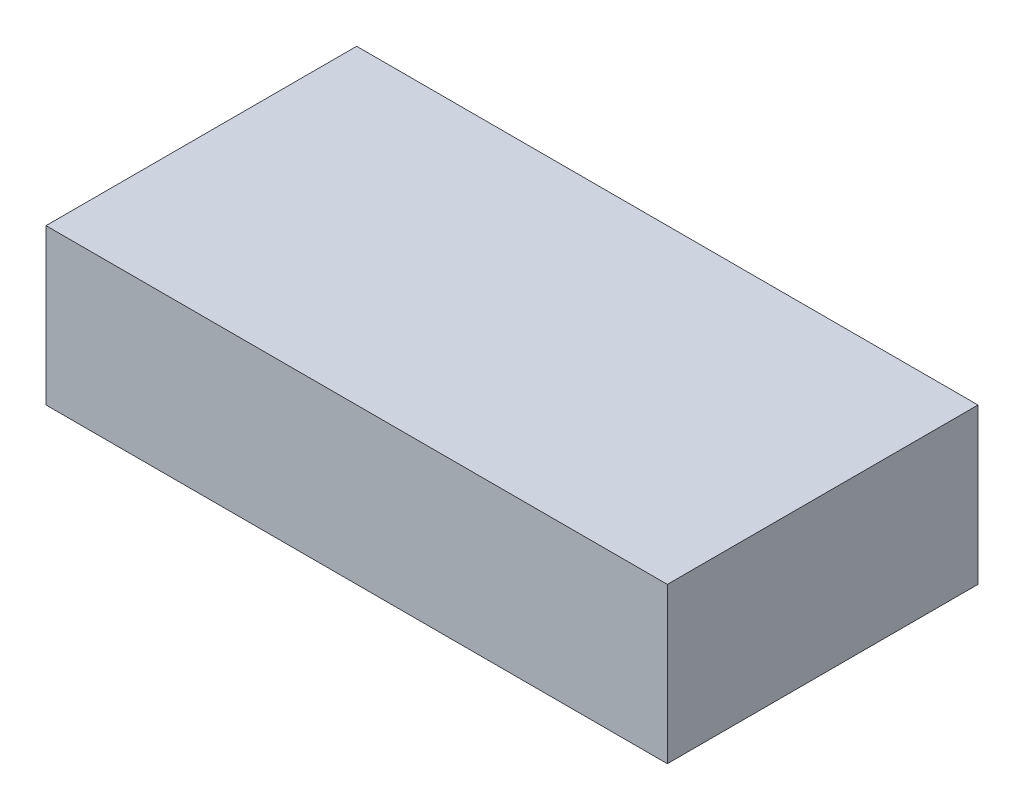
from build123d import *

# Parameters (mm, degrees)
SKETCH1_W           = 101.6
SKETCH1_H           = 50.8
BOSS_EXTRUDE1_DEPTH = 25.4


with BuildPart() as part:
    # Sketch1 → Boss-Extrude1 (new body)
    with BuildSketch(Plane(origin=(0, 0, 0), x_dir=(1, 0, 0), z_dir=(0, 1, 0))):
        with Locations((50.8, 25.4)):
            Rectangle(SKETCH1_W, SKETCH1_H)
    extrude(amount=BOSS_EXTRUDE1_DEPTH)


solid = part.part
